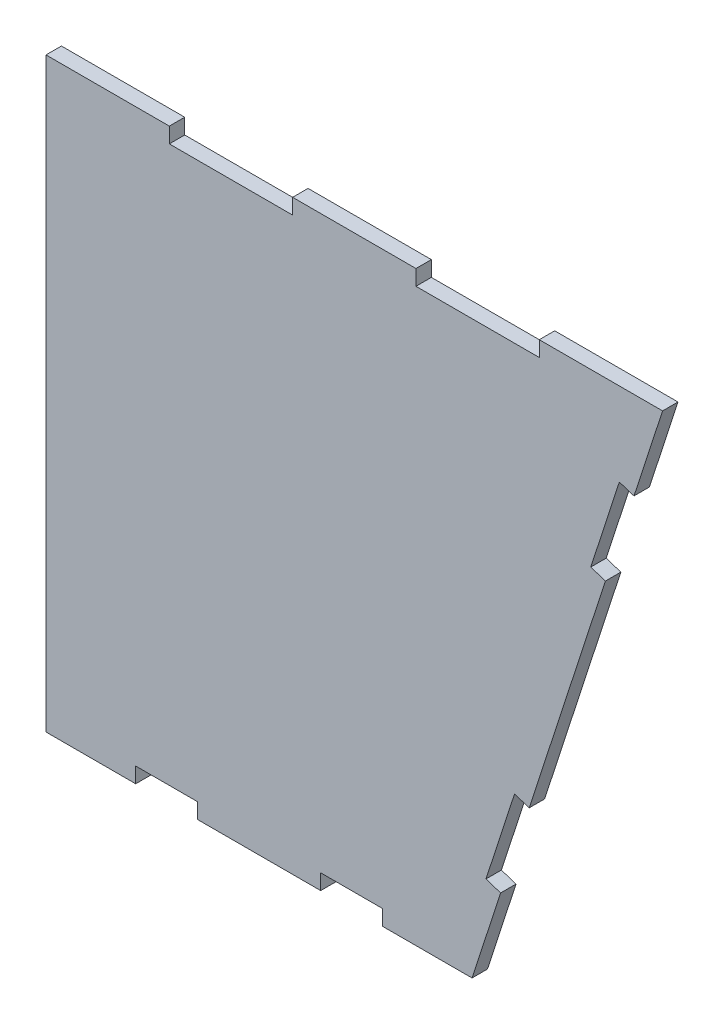
from build123d import *

# Parameters (mm, degrees)
BOSS_EXTRUDE1_DEPTH = 3.175


with BuildPart() as part:
    # Sketch1 → Boss-Extrude1 (new body)
    with BuildSketch(Plane.XY):
        Polygon((0, 0), (5.886773743, 18.117626635), (2.867169304, 19.098755593), (8.753943046, 37.216382228), (11.773547486, 36.235253271), (27.4716108, 84.548924299), (24.452006361, 85.530053256), (30.338780104, 103.647679891), (33.358384543, 102.666550934), (39.245158286, 120.784177569), (13.845158286, 120.784177569), (13.845158286, 117.609177569), (-11.554841714, 117.609177569), (-11.554841714, 120.784177569), (-36.954841714, 120.784177569), (-36.954841714, 117.609177569), (-62.354841714, 117.609177569), (-62.354841714, 120.784177569), (-87.754841714, 120.784177569), (-87.754841714, 0), (-69.277420857, 0), (-69.277420857, 3.175), (-56.577420857, 3.175), (-56.577420857, 0), (-31.177420857, 0), (-31.177420857, 3.175), (-18.477420857, 3.175), (-18.477420857, 0), align=None)
    extrude(amount=BOSS_EXTRUDE1_DEPTH)


solid = part.part
